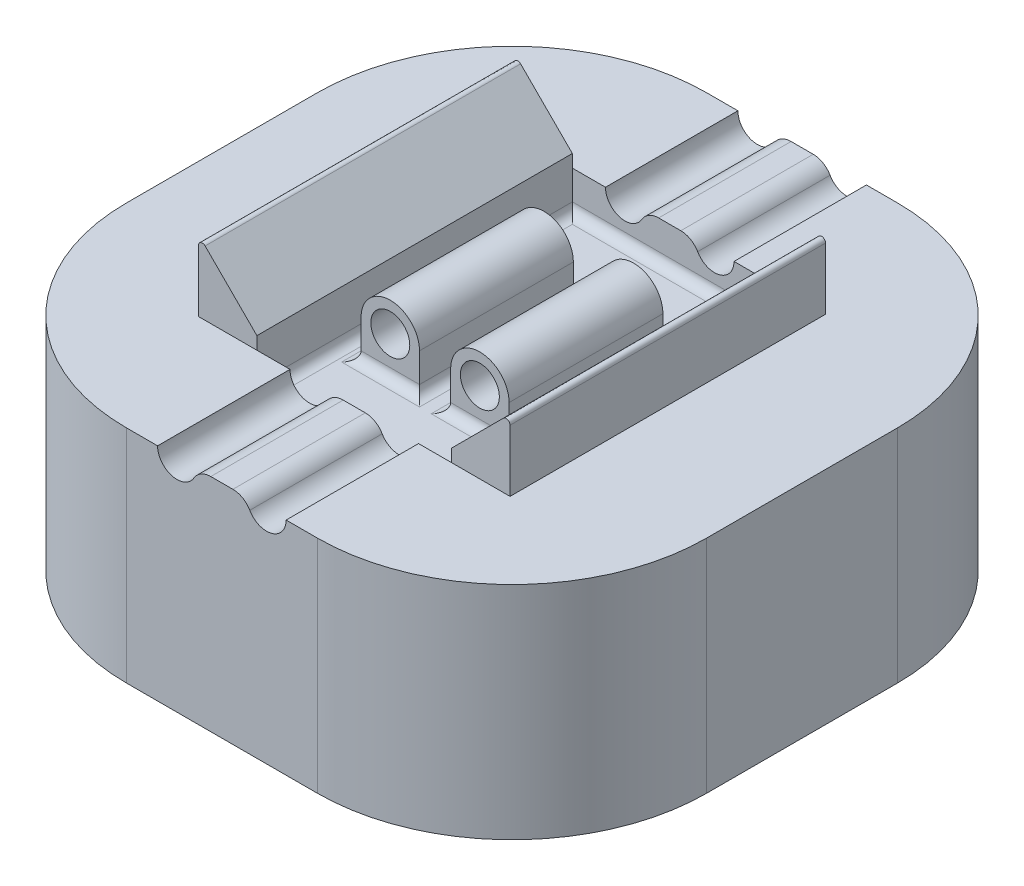
from build123d import *

# Parameters (mm, degrees)
SKETCH2_W               = 29.8
SKETCH2_H               = 29.8
BOSS_EXTRUDE1_DEPTH     = 6.35
SKETCH3_W               = 29.8
SKETCH3_H               = 29.8
BOSS_EXTRUDE2_DEPTH     = 5
FILLET1_R               = 10
SKETCH5_W               = 10
SKETCH5_H               = 16.2
CUT_EXTRUDE1_DEPTH      = 2
SKETCH4_W               = 1.5
SKETCH4_H               = 7.9
SKETCH4_4_W             = 1.5
SKETCH4_4_H             = 7.9
SKETCH6_W               = 3
SKETCH6_H               = 5
BOSS_EXTRUDE3_DEPTH     = 7.9
FILLET3_R               = 0.5
CUT_EXTRUDE2_DEPTH      = 28.248027452
CUT_EXTRUDE2_DEPTH_BACK = 28.248027452
SKETCH7_R               = 1
SKETCH8_R               = 2.125
CUT_EXTRUDE3_DEPTH      = 5
SKETCH9_W               = 3
SKETCH9_H               = 16.2
BOSS_EXTRUDE4_DEPTH     = 0.65
BOSS_EXTRUDE5_DEPTH     = 16.2
FILLET4_R               = 0.2
FILLET5_R               = 1


with BuildPart() as part:
    # Sketch2 → Boss-Extrude1 (new body)
    with BuildSketch(Plane(origin=(0, 0, 0), x_dir=(1, 0, 0), z_dir=(0, 1, 0))):
        Rectangle(SKETCH2_W, SKETCH2_H)
    extrude(amount=BOSS_EXTRUDE1_DEPTH)

    # Sketch3 → Boss-Extrude2 (add)
    with BuildSketch(Plane(origin=(0, 6.35, 0), x_dir=(1, 0, 0), z_dir=(0, 1, 0))):
        Rectangle(SKETCH3_W, SKETCH3_H)
    extrude(amount=BOSS_EXTRUDE2_DEPTH)

    # Fillet1
    fillet1_edges = [part.edges().sort_by_distance(p)[0] for p in [
        (-14.9, 5.675, -14.9),
        (14.9, 5.675, -14.9),
        (14.9, 5.675, 14.9),
        (-14.9, 5.675, 14.9),
    ]]
    fillet(fillet1_edges, radius=FILLET1_R)

    # Sketch5 → Cut-Extrude1 (cut)
    with BuildSketch(Plane(origin=(0, 11.35, 0), x_dir=(1, 0, 0), z_dir=(0, 1, 0))):
        Rectangle(SKETCH5_W, SKETCH5_H)
    extrude(amount=-CUT_EXTRUDE1_DEPTH, mode=Mode.SUBTRACT)



with BuildPart() as body_2:
    # Sketch4 → Revolve1 (revolve)
    with BuildSketch(Plane(origin=(0, 11.35, 0), x_dir=(1, 0, 0), z_dir=(0, 1, 0))):
        with Locations((-3.05, 0)):
            Rectangle(SKETCH4_W, SKETCH4_H)
    revolve(axis=Axis((-2.3, 11.35, -3.95), (0, 0, 1)))


with BuildPart() as body_3:
    # Sketch4<4> → Revolve2 (revolve)
    with BuildSketch(Plane(origin=(0, 11.35, 0), x_dir=(1, 0, 0), z_dir=(0, 1, 0)), mode=Mode.PRIVATE) as revolve2_sk:
        with Locations((3.05, 0)):
            Rectangle(SKETCH4_4_W, SKETCH4_4_H)
    revolve(revolve2_sk.sketch.rotate(Axis((2.3, 11.35, -3.95), (0, 0, 1)), 180), axis=Axis((2.3, 11.35, -3.95), (0, 0, 1)))


with BuildPart() as part_1:
    add(part.part)

    add(body_2.part)  # Boss-Extrude3 merges body 2

    add(body_3.part)  # Boss-Extrude3 merges body 3
    # Sketch6 → Boss-Extrude3 (add)
    with BuildSketch(Plane.XY.offset(3.95)):
        with BuildLine():
            ThreePointArc((-0.8, 11.35), (-2.3, 9.85), (-3.8, 11.35))
            Line((-3.8, 11.35), (-3.8, 6.35))
            Line((-3.8, 6.35), (-0.8, 6.35))
            Line((-0.8, 6.35), (-0.8, 11.35))
        make_face()
        with Locations((2.3, 8.85)):
            Rectangle(SKETCH6_W, SKETCH6_H)
        with BuildLine():
            ThreePointArc((-0.8, 11.35), (-2.3, 12.85), (-3.8, 11.35))
            Line((-3.8, 11.35), (-0.8, 11.35))
        make_face()
        with BuildLine():
            Line((-0.8, 11.35), (-3.8, 11.35))
            ThreePointArc((-3.8, 11.35), (-2.3, 9.85), (-0.8, 11.35))
        make_face()
    extrude(amount=-BOSS_EXTRUDE3_DEPTH)

    # Fillet3
    fillet3_edges = [part_1.edges().sort_by_distance(p)[0] for p in [
        (-0.8, 9.35, 0),
        (-3.8, 9.35, 0),
        (-2.3, 9.35, 3.95),
        (-2.3, 9.35, -3.95),
        (5, 9.35, 0),
        (0, 9.35, -8.1),
        (-5, 9.35, 0),
        (0, 9.35, 8.1),
        (2.3, 9.35, -3.95),
        (0.8, 9.35, 0),
        (3.8, 9.35, 0),
        (2.3, 9.35, 3.95),
    ]]
    fillet(fillet3_edges, radius=FILLET3_R)

    # Sketch7 → Cut-Extrude2 (cut, two sides: drawn at the far end of the back side and taken through both)
    with BuildSketch(Plane.XY.offset(3.95).offset(-CUT_EXTRUDE2_DEPTH_BACK)):
        with Locations((2.3, 11.35)):
            Circle(SKETCH7_R)
        with Locations((-2.3, 11.35)):
            Circle(SKETCH7_R)
    extrude(amount=CUT_EXTRUDE2_DEPTH + CUT_EXTRUDE2_DEPTH_BACK, mode=Mode.SUBTRACT)

    # Sketch8 → Cut-Extrude3 (cut)
    with BuildSketch(Plane.XZ):
        with Locations(Location((0, 0, 0), (0, 0, 270))):
            Circle(SKETCH8_R)
    extrude(amount=-CUT_EXTRUDE3_DEPTH, mode=Mode.SUBTRACT)

    # Sketch9 → Boss-Extrude4 (add)
    with BuildSketch(Plane(origin=(0, 11.35, 0), x_dir=(1, 0, 0), z_dir=(0, 1, 0))):
        with Locations((-6.5, 0)):
            Rectangle(SKETCH9_W, SKETCH9_H)
        with Locations((6.5, 0)):
            Rectangle(SKETCH9_W, SKETCH9_H)
    extrude(amount=BOSS_EXTRUDE4_DEPTH)

    # Sketch10 → Boss-Extrude5 (add)
    with BuildSketch(Plane.XY.offset(8.1)):
        Polygon((8, 15), (8, 12), (5, 12), align=None)
        Polygon((-5, 12), (-8, 15), (-8, 12), align=None)
    extrude(amount=-BOSS_EXTRUDE5_DEPTH)

    # Fillet4
    fillet4_edges = [part_1.edges().sort_by_distance(p)[0] for p in [
        (8, 15, 0),
        (-8, 15, 0),
    ]]
    fillet(fillet4_edges, radius=FILLET4_R)

    # Fillet5
    fillet5_edges = [part_1.edges().sort_by_distance(p)[0] for p in [
        (1.3, 11.35, 11.5),
        (1.3, 11.35, -11.5),
        (-1.3, 11.35, 11.5),
        (-1.3, 11.35, -11.5),
    ]]
    fillet(fillet5_edges, radius=FILLET5_R)


solid = part_1.part
